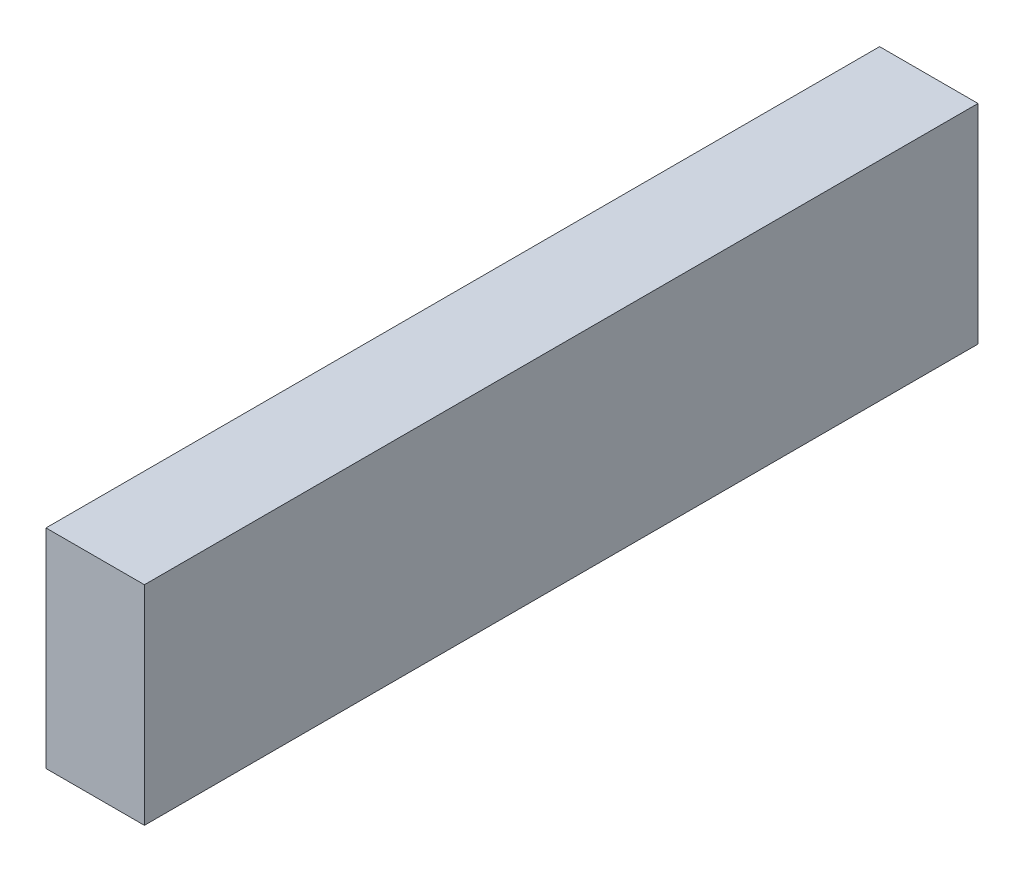
from build123d import *

# Parameters (mm, degrees)
SKETCH1_W           = 17.991666666
SKETCH1_H           = 38.1
BOSS_EXTRUDE1_DEPTH = 76.2


with BuildPart() as part:
    # Sketch1 → Boss-Extrude1 (new, symmetric)
    with BuildSketch(Plane.XY):
        Rectangle(SKETCH1_W, SKETCH1_H)
    extrude(amount=BOSS_EXTRUDE1_DEPTH, both=True)


solid = part.part
